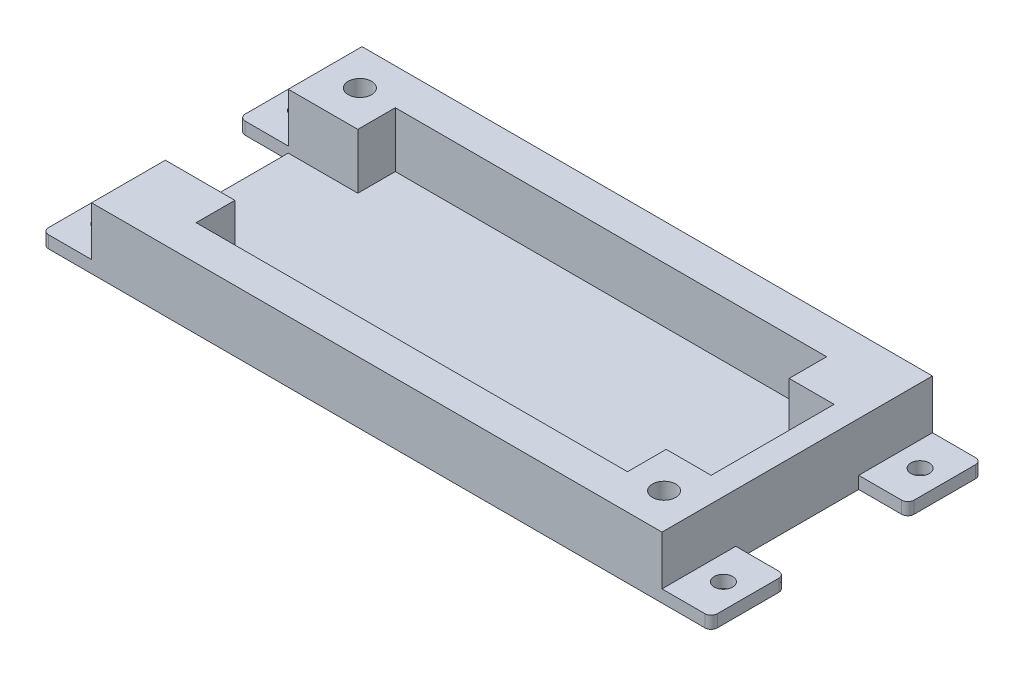
from build123d import *

# Parameters (mm, degrees)
ESBO_O1_W                = 46.4
ESBO_O1_H                = 22
ESBO_O1_R                = 0.95
RESSALTO_EXTRUS_O1_DEPTH = 4.5
ESBO_O2_W                = 46.4
ESBO_O2_H                = 22
RESSALTO_EXTRUS_O2_DEPTH = 0.5
ESBO_O4_R                = 1.05
CORTE_EXTRUS_O2_DEPTH    = 10.5
ESBO_O8_R                = 2
CORTE_EXTRUS_O3_DEPTH    = 3
RESSALTO_EXTRUS_O3_DEPTH = 0.5
ESBO_O11_R               = 0.75
CORTE_EXTRUS_O5_DEPTH    = 10
ESBO_O12_W               = 40.744
ESBO_O12_H               = 10
CORTE_EXTRUS_O6_DEPTH    = 4.5


with BuildPart() as part:
    # Esboço1 → Ressalto-extrusão1 (new body)
    with BuildSketch(Plane(origin=(0, 0, 0), x_dir=(1, 0, 0), z_dir=(0, 1, 0))):
        Rectangle(ESBO_O1_W, ESBO_O1_H)
        with Locations(Location((20.372, -8, 0), (0, 0, 270))):
            Circle(ESBO_O1_R, mode=Mode.SUBTRACT)
        with Locations(Location((-20.372, 8, 0), (0, 0, 270))):
            Circle(ESBO_O1_R, mode=Mode.SUBTRACT)
        Polygon((-21.2, 5), (-17.544, 5), (-17.544, 8.05), (17.544, 8.05), (17.544, 5), (21.2, 5), (21.2, -5), (17.544, -5), (17.544, -8.15), (-17.544, -8.15), (-17.544, -5), (-21.2, -5), align=None, mode=Mode.SUBTRACT)
    extrude(amount=RESSALTO_EXTRUS_O1_DEPTH)

    # Esboço2 → Ressalto-extrusão2 (add)
    with BuildSketch(Plane.XZ):
        Rectangle(ESBO_O2_W, ESBO_O2_H)
    extrude(amount=RESSALTO_EXTRUS_O2_DEPTH)

    # Esboço4 → Corte-extrusão2 (cut)
    with BuildSketch(Plane(origin=(0, 0, 0), x_dir=(1, 0, 0), z_dir=(0, 1, 0))):
        with Locations(Location((20.372, -8, 0), (0, 0, 270))):
            Circle(ESBO_O4_R)
        with Locations(Location((-20.372, 8, 0), (0, 0, 270))):
            Circle(ESBO_O4_R)
    extrude(amount=-CORTE_EXTRUS_O2_DEPTH, mode=Mode.SUBTRACT)

    # Esboço8 → Corte-extrusão3 (cut)
    with BuildSketch(Plane(origin=(0, -0.5, 0), x_dir=(1, 0, 0), z_dir=(0, 1, 0))):
        with Locations(Location((20.372, -8, 0), (0, 0, 270))):
            Circle(ESBO_O8_R)
        with Locations(Location((-20.372, 8.05, 0), (0, 0, 270))):
            Circle(ESBO_O8_R)
    extrude(amount=CORTE_EXTRUS_O3_DEPTH, mode=Mode.SUBTRACT)

    # Esboço10 → Ressalto-extrusão3 (add, symmetric)
    with BuildSketch(Plane(origin=(0, 0, 0), x_dir=(1, 0, 0), z_dir=(0, 1, 0))):
        with BuildLine():
            Line((-23.2, 11), (-26.7, 11))
            ThreePointArc((-26.7, 11), (-27.053553391, 10.853553391), (-27.2, 10.5))
            Line((-27.2, 10.5), (-27.2, 5.5))
            ThreePointArc((-27.2, 5.5), (-27.053553391, 5.146446609), (-26.7, 5))
            Line((-26.7, 5), (-23.2, 5))
            Line((-23.2, 5), (-23.2, 11))
        make_face()
        with BuildLine():
            Line((-23.2, -11), (-26.7, -11))
            ThreePointArc((-26.7, -11), (-27.053553391, -10.853553391), (-27.2, -10.5))
            Line((-27.2, -10.5), (-27.2, -5.5))
            ThreePointArc((-27.2, -5.5), (-27.053553391, -5.146446609), (-26.7, -5))
            Line((-26.7, -5), (-23.2, -5))
            Line((-23.2, -5), (-23.2, -11))
        make_face()
        with BuildLine():
            Line((23.2, 11), (26.7, 11))
            ThreePointArc((26.7, 11), (27.053553391, 10.853553391), (27.2, 10.5))
            Line((27.2, 10.5), (27.2, 5.5))
            ThreePointArc((27.2, 5.5), (27.053553391, 5.146446609), (26.7, 5))
            Line((26.7, 5), (23.2, 5))
            Line((23.2, 5), (23.2, 11))
        make_face()
        with BuildLine():
            Line((23.2, -11), (26.7, -11))
            ThreePointArc((26.7, -11), (27.053553391, -10.853553391), (27.2, -10.5))
            Line((27.2, -10.5), (27.2, -5.5))
            ThreePointArc((27.2, -5.5), (27.053553391, -5.146446609), (26.7, -5))
            Line((26.7, -5), (23.2, -5))
            Line((23.2, -5), (23.2, -11))
        make_face()
    extrude(amount=RESSALTO_EXTRUS_O3_DEPTH, both=True)

    # Esboço11 → Corte-extrusão5 (cut)
    with BuildSketch(Plane(origin=(0, 0.5, 0), x_dir=(1, 0, 0), z_dir=(0, 1, 0))):
        with Locations(Location((-25.2, 8, 0), (0, 0, 270))):
            Circle(ESBO_O11_R)
        with Locations(Location((-25.2, -8, 0), (0, 0, 270))):
            Circle(ESBO_O11_R)
        with Locations(Location((25.2, -8, 0), (0, 0, 270))):
            Circle(ESBO_O11_R)
        with Locations(Location((25.2, 8, 0), (0, 0, 270))):
            Circle(ESBO_O11_R)
    extrude(amount=-CORTE_EXTRUS_O5_DEPTH, mode=Mode.SUBTRACT)

    # Esboço12 → Corte-extrusão6 (cut)
    with BuildSketch(Plane(origin=(0, 4.5, 0), x_dir=(1, 0, 0), z_dir=(0, 1, 0))):
        with Locations((-2.828, 0)):
            Rectangle(ESBO_O12_W, ESBO_O12_H)
    extrude(amount=-CORTE_EXTRUS_O6_DEPTH, mode=Mode.SUBTRACT)


solid = part.part
